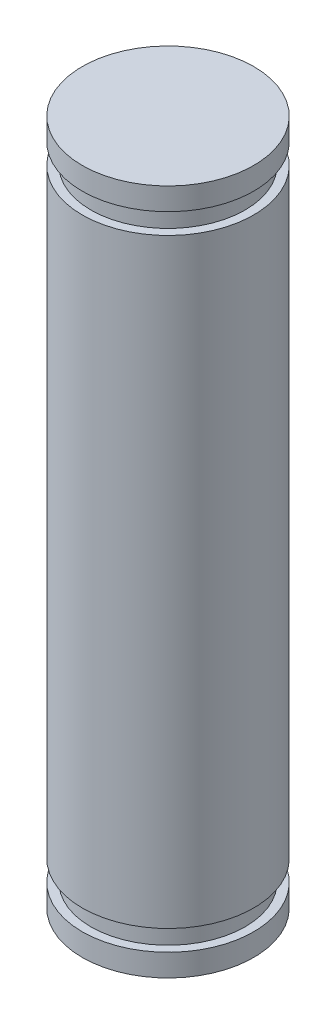
from build123d import *


with BuildPart() as part:
    # 草图1 → 旋转1 (revolve)
    with BuildSketch(Plane.XY, mode=Mode.PRIVATE) as revolve_1_sk:
        Polygon((-6.955644483, 36.114936393), (-11.955644483, 36.114936393), (-11.955644483, 76.114936393), (-6.955644483, 76.114936393), (-6.955644483, 74.814936393), (-7.455644483, 74.814936393), (-7.455644483, 73.614936393), (-6.955644483, 73.614936393), (-6.955644483, 38.614936393), (-7.455644483, 38.614936393), (-7.455644483, 37.414936393), (-6.955644483, 37.414936393), align=None)
    revolve(revolve_1_sk.sketch.rotate(Axis((-11.955644483, 36.114936393, 0), (0, 1, 0)), 90), axis=Axis((-11.955644483, 36.114936393, 0), (0, 1, 0)))


solid = part.part
